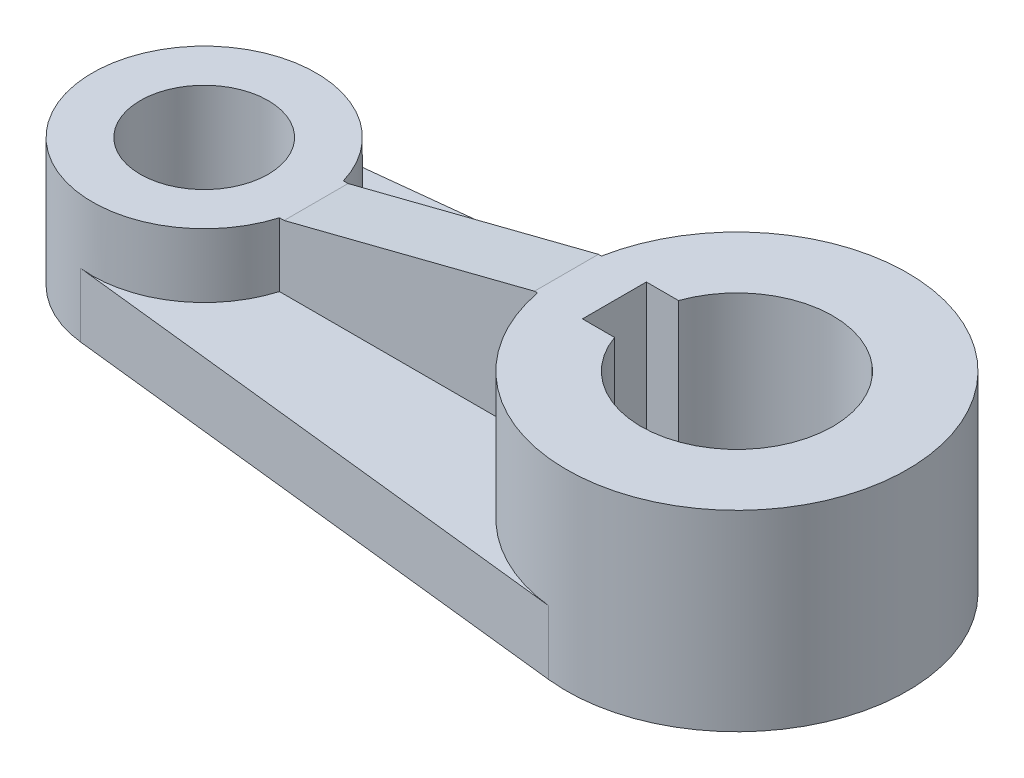
from build123d import *

# Parameters (mm, degrees)
SKETCH1_R           = 32
SKETCH1_R_2         = 18
BOSS_EXTRUDE1_DEPTH = 36
SKETCH2_R           = 21
SKETCH2_R_2         = 12
BOSS_EXTRUDE2_DEPTH = 24
SKETCH3_R           = 18
SKETCH3_R_2         = 12
BOSS_EXTRUDE3_DEPTH = 12
CUT_EXTRUDE1_DEPTH  = 131.234404057
BOSS_EXTRUDE4_DEPTH = 6


with BuildPart() as part:
    # Sketch1 → Boss-Extrude1 (new body)
    with BuildSketch(Plane(origin=(0, 0, 0), x_dir=(1, 0, 0), z_dir=(0, 1, 0))):
        with Locations(Location((0, 0, 0), (0, 0, 270))):
            Circle(SKETCH1_R)
        with Locations(Location((0, 0, 0), (0, 0, 270))):
            Circle(SKETCH1_R_2, mode=Mode.SUBTRACT)
    extrude(amount=BOSS_EXTRUDE1_DEPTH)



with BuildPart() as body_2:
    # Sketch2 → Boss-Extrude2 (new body)
    with BuildSketch(Plane(origin=(0, 0, 0), x_dir=(1, 0, 0), z_dir=(0, 1, 0))):
        with Locations(Location((-100, 0, 0), (0, 0, 270))):
            Circle(SKETCH2_R)
        with Locations(Location((-100, 0, 0), (0, 0, 270))):
            Circle(SKETCH2_R_2, mode=Mode.SUBTRACT)
    extrude(amount=BOSS_EXTRUDE2_DEPTH)


with BuildPart() as part_1:
    add(part.part)

    add(body_2.part)  # Boss-Extrude3 merges body 2
    # Sketch3 → Boss-Extrude3 (add)
    with BuildSketch(Plane.XZ):
        with BuildLine():
            Line((-102.31, 20.872563331), (-3.52, 31.80581079))
            ThreePointArc((-3.52, 31.80581079), (32, 0), (-3.52, -31.80581079))
            Line((-3.52, -31.80581079), (-102.31, -20.872563331))
            ThreePointArc((-102.31, -20.872563331), (-121, 0), (-102.31, 20.872563331))
        make_face()
        with Locations(Location((0, 0, 0), (0, 0, 90))):
            Circle(SKETCH3_R, mode=Mode.SUBTRACT)
        with Locations(Location((-100, 0, 0), (0, 0, 270))):
            Circle(SKETCH3_R_2, mode=Mode.SUBTRACT)
    extrude(amount=-BOSS_EXTRUDE3_DEPTH)

    # Sketch4 → Cut-Extrude1 (cut, through all)
    with BuildSketch(Plane(origin=(0, 36, 0), x_dir=(1, 0, 0), z_dir=(0, 1, 0))):
        with BuildLine():
            Line((-23.000562748, 6), (-16.970562748, 6))
            ThreePointArc((-16.970562748, 6), (-18, 0), (-16.970562748, -6))
            Line((-16.970562748, -6), (-23.000562748, -6))
            Line((-23.000562748, -6), (-23.000562748, 6))
        make_face()
    extrude(amount=-CUT_EXTRUDE1_DEPTH, mode=Mode.SUBTRACT)

    # Sketch5 → Boss-Extrude4 (add, symmetric)
    with BuildSketch(Plane.XY):
        Polygon((-80.173004722, 12), (-80.173004722, 24), (-79, 24), (-32, 36), (-30.333655542, 36), (-30.333655542, 12), align=None)
    extrude(amount=BOSS_EXTRUDE4_DEPTH, both=True)


solid = part_1.part
